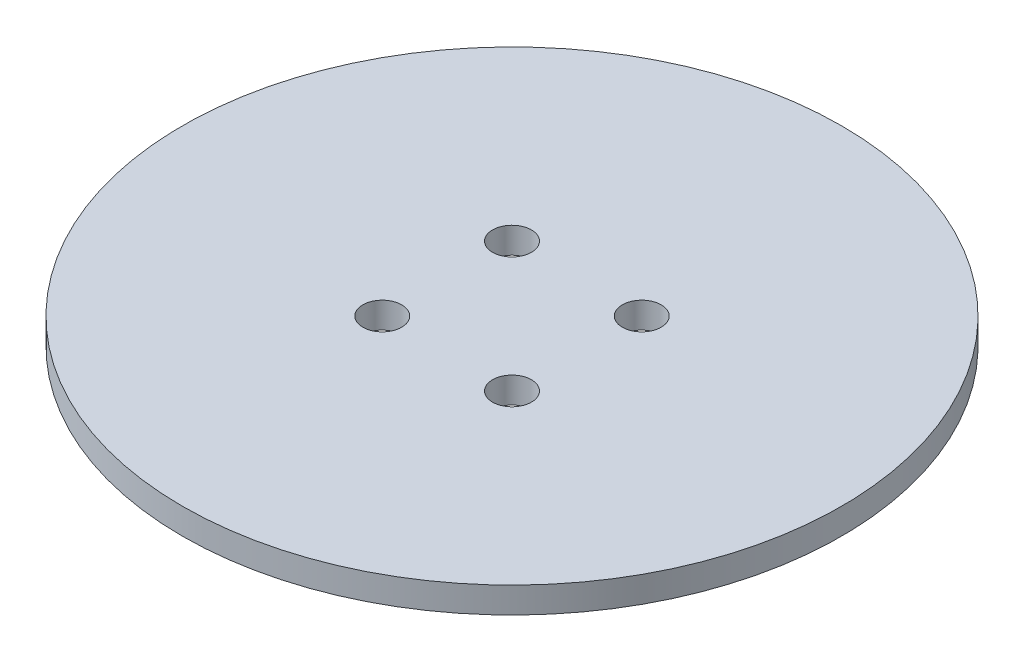
from build123d import *

# Parameters (mm, degrees)
SKETCH1_R             = 38.1
BOSS_EXTRUDE1_DEPTH   = 3
F_8_CLEARANCE_HOLE1_D = 4.4958


with BuildPart() as part:
    # Sketch1 → Boss-Extrude1 (new body)
    with BuildSketch(Plane(origin=(0, 0, 0), x_dir=(1, 0, 0), z_dir=(0, 1, 0))):
        with Locations(Location((0, 0, 0), (0, 0, 270))):
            Circle(SKETCH1_R)
    extrude(amount=BOSS_EXTRUDE1_DEPTH)

    # #8 Clearance Hole1 (through all)
    with Locations(Plane(origin=(0, 3, 0), x_dir=(1, 0, 0), z_dir=(0, 1, 0))):
        with Locations((-7.5, 7.5), (7.5, 7.5), (-7.5, -7.5), (7.5, -7.5)):
            Hole(F_8_CLEARANCE_HOLE1_D / 2)


solid = part.part
